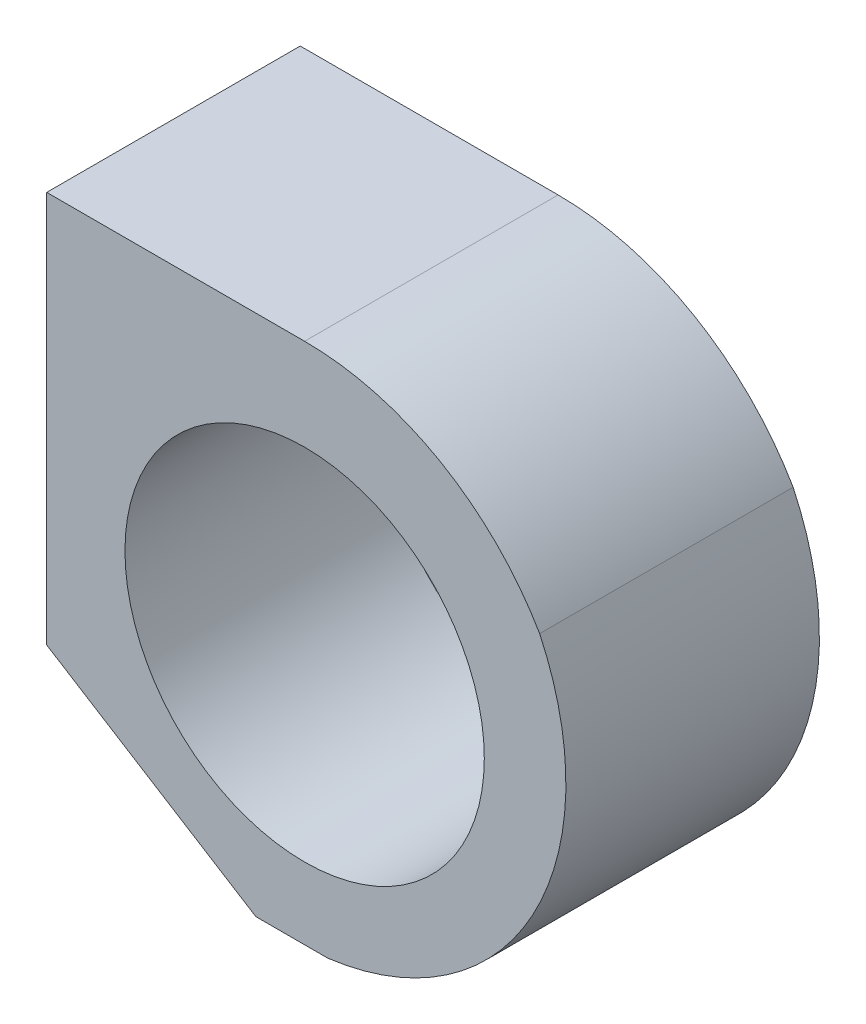
from build123d import *

# Parameters (mm, degrees)
SKETCH2_R           = 13.75
BOSS_EXTRUDE1_DEPTH = 19.4


with BuildPart() as part:
    # Sketch2 → Boss-Extrude1 (new body)
    with BuildSketch(Plane.XY):
        with BuildLine():
            Line((-19.738634508, 20.767211648), (-19.738634508, -9.232788352))
            Line((-19.738634508, -9.232788352), (-3.735289218, -19.232788352))
            Line((-3.735289218, -19.232788352), (1.773741407, -19.232788352))
            ThreePointArc((1.773741407, -19.232788352), (17.434536233, -8.560097374), (17.984932853, 10.383605824))
            ThreePointArc((17.984932853, 10.383605824), (10.383605824, 17.984932853), (0, 20.767211648))
            Line((0, 20.767211648), (-19.738634508, 20.767211648))
        make_face()
        with Locations(Location((0, 0, 0), (0, 0, 180))):
            Circle(SKETCH2_R, mode=Mode.SUBTRACT)
    extrude(amount=BOSS_EXTRUDE1_DEPTH)


solid = part.part
